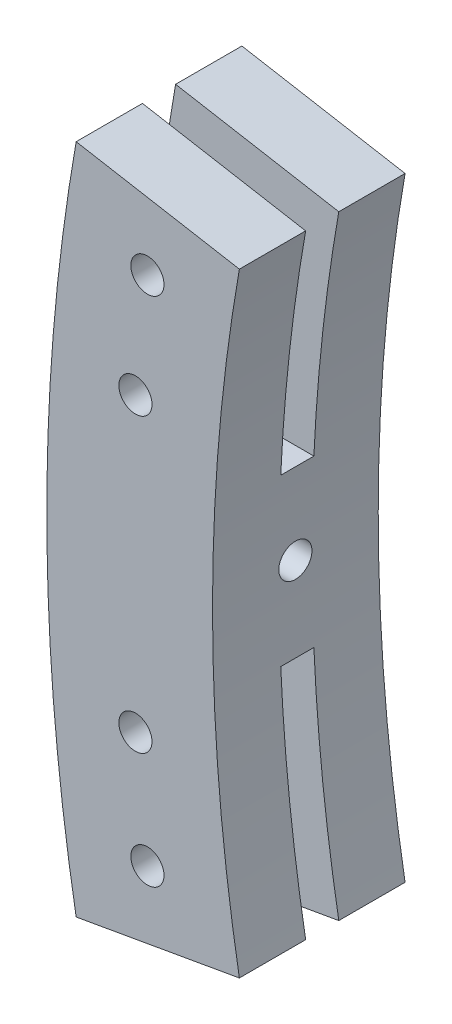
from build123d import *

# Parameters (mm, degrees)
BOSS_EXTRUDE3_DEPTH   = 7.5
CUT_EXTRUDE4_DEPTH    = 1.5
BOSS_EXTRUDE5_DEPTH   = 1.5
SKETCH4_R             = 3
BEARING_HOLE_DEPTH    = 1.25
SHAFT_HOLE_DEPTH      = 33.837885572
SHAFT_HOLE_DEPTH_BACK = 33.837885572
SKETCH7_R             = 1.5
SKETCH3_R             = 1.5
MOUNT_HOLE_DEPTH      = 178.777126728


with BuildPart() as part:
    # Sketch1 → Boss-Extrude3 (new, symmetric)
    with BuildSketch(Plane.XY):
        with BuildLine():
            ThreePointArc((-157.569240482, -27.783708427), (-160, 0), (-157.569240482, 27.783708427))
            Line((-157.569240482, 27.783708427), (-172.341356777, 30.388431092))
            ThreePointArc((-172.341356777, 30.388431092), (-175, 0), (-172.341356777, -30.388431092))
            Line((-172.341356777, -30.388431092), (-157.569240482, -27.783708427))
        make_face()
    extrude(amount=BOSS_EXTRUDE3_DEPTH, both=True)

    # Sketch1<6> → Cut-Extrude4 (cut, symmetric)
    with BuildSketch(Plane.XY):
        with BuildLine():
            Line((-157.569240482, 27.783708427), (-172.341356777, 30.388431092))
            ThreePointArc((-172.341356777, 30.388431092), (-175, 0), (-172.341356777, -30.388431092))
            Line((-172.341356777, -30.388431092), (-157.569240482, -27.783708427))
            ThreePointArc((-157.569240482, -27.783708427), (-160, 0), (-157.569240482, 27.783708427))
        make_face()
    extrude(amount=CUT_EXTRUDE4_DEPTH, both=True, mode=Mode.SUBTRACT)


with BuildPart() as cut_extrude4_piece_1:
    # of the separate pieces the step leaves, piece 1, a body of its own (cut_extrude4_pieces)
    add(part.part.solids().sort_by_distance((-157.569240482, -27.783708427, -1.5))[0])



with BuildPart() as cut_extrude4_piece_2:
    # of the separate pieces the step leaves, piece 2, a body of its own (cut_extrude4_pieces)
    add(part.part.solids().sort_by_distance((-157.569240482, -27.783708427, 7.5))[0])


with BuildPart() as cut_extrude4_piece_1_1:
    add(cut_extrude4_piece_1.part)

    add(cut_extrude4_piece_2.part)  # Boss-Extrude5 merges Cut-Extrude4 piece 2
    # Sketch6 → Boss-Extrude5 (add, symmetric)
    with BuildSketch(Plane.XY):
        with BuildLine():
            Line((-159.824122084, 7.5), (-174.839211849, 7.5))
            ThreePointArc((-174.839211849, 7.5), (-175, 0), (-174.839211849, -7.5))
            Line((-174.839211849, -7.5), (-159.824122084, -7.5))
            ThreePointArc((-159.824122084, -7.5), (-160, 0), (-159.824122084, 7.5))
        make_face()
    extrude(amount=BOSS_EXTRUDE5_DEPTH, both=True)

    # Sketch4 → bearing hole (cut, symmetric)
    with BuildSketch(Plane(origin=(-167.5, 0, 0), x_dir=(0, 0, -1), z_dir=(1, 0, 0))):
        Circle(SKETCH4_R)
    extrude(amount=BEARING_HOLE_DEPTH, both=True, mode=Mode.SUBTRACT)

    # Sketch7 → shaft hole (cut, two sides: drawn at the far end of the back side and taken through both)
    with BuildSketch(Plane(origin=(-167.5, 0, 0), x_dir=(0, 0, -1), z_dir=(1, 0, 0)).offset(-SHAFT_HOLE_DEPTH_BACK)):
        Circle(SKETCH7_R)
    extrude(amount=SHAFT_HOLE_DEPTH + SHAFT_HOLE_DEPTH_BACK, mode=Mode.SUBTRACT)

    # Sketch3 → mount hole (cut, symmetric)
    with BuildSketch(Plane(origin=(0, 0, 0), x_dir=(-1, 0, 0), z_dir=(0, 0, -1))):
        with Locations((165.891323638, 23.158556552)):
            Circle(SKETCH3_R)
        with Locations((166.977667312, 13.217738807)):
            Circle(SKETCH3_R)
    mount_hole = extrude(amount=MOUNT_HOLE_DEPTH, both=True, mode=Mode.SUBTRACT)

    # Mirror1: mount hole across plane
    add(mount_hole.mirror(Plane.ZX), mode=Mode.SUBTRACT)


solid = cut_extrude4_piece_1_1.part
